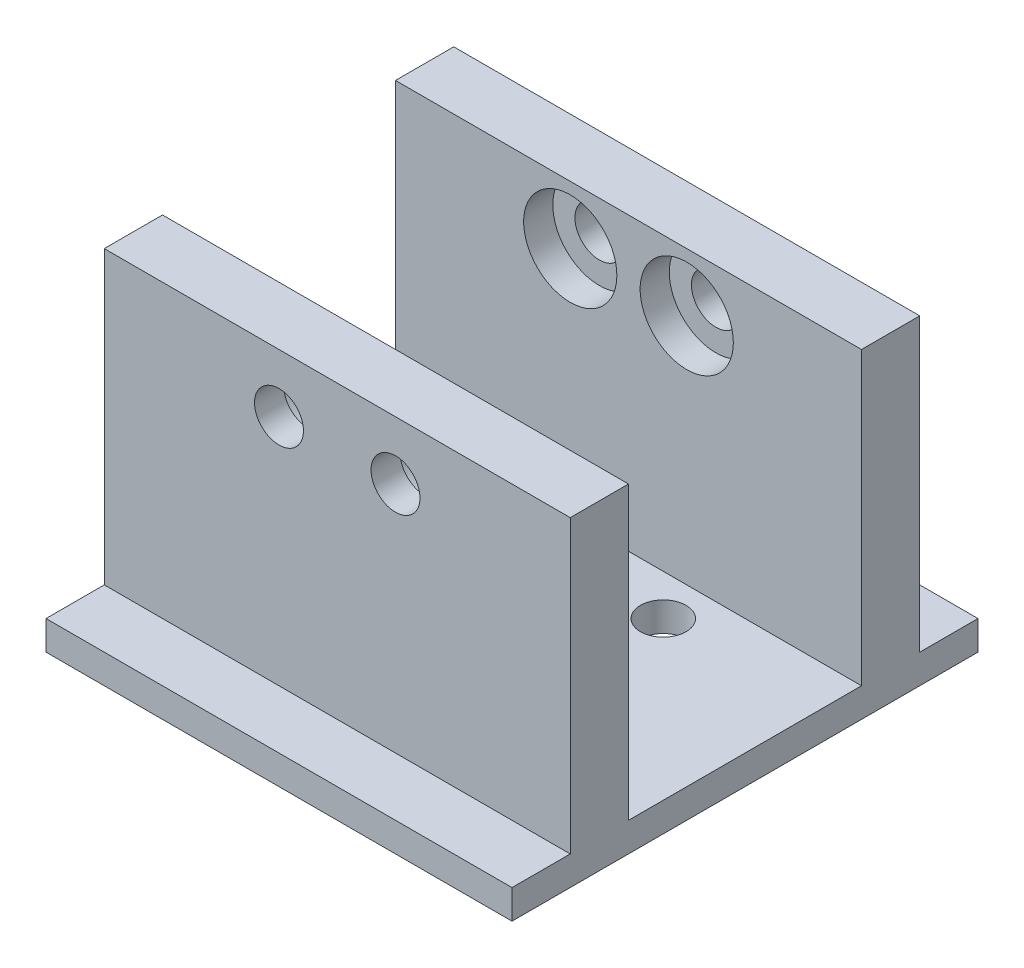
from build123d import *

# Parameters (mm, degrees)
SKETCH1_W           = 50.8
SKETCH1_H           = 50.8
SKETCH1_R           = 2.4892
SKETCH1_R_2         = 7.62
BOSS_EXTRUDE1_DEPTH = 3.175
SKETCH2_W           = 50.8
SKETCH2_H           = 6.35
BOSS_EXTRUDE2_DEPTH = 31.75
CUT_EXTRUDE1_REACH  = 63.974
SKETCH3_R           = 2.667
SKETCH5_R           = 5.08
CUT_EXTRUDE2_DEPTH  = 3.175
CUT_EXTRUDE3_START  = -3.175
SKETCH6_R           = 5.08
CUT_EXTRUDE3_DEPTH  = 3.175


with BuildPart() as part:
    # Sketch1 → Boss-Extrude1 (new body)
    with BuildSketch(Plane(origin=(0, 0, 0), x_dir=(1, 0, 0), z_dir=(0, 1, 0))):
        Rectangle(SKETCH1_W, SKETCH1_H)
        with Locations(Location((-8.243875119, 8.243875119, 0), (0, 0, 270))):
            Circle(SKETCH1_R, mode=Mode.SUBTRACT)
        with Locations(Location((8.243875119, 8.243875119, 0), (0, 0, 270))):
            Circle(SKETCH1_R, mode=Mode.SUBTRACT)
        with Locations(Location((8.243875119, -8.243875119, 0), (0, 0, 270))):
            Circle(SKETCH1_R, mode=Mode.SUBTRACT)
        with Locations(Location((-8.243875119, -8.243875119, 0), (0, 0, 270))):
            Circle(SKETCH1_R, mode=Mode.SUBTRACT)
        with Locations(Location((0, 0, 0), (0, 0, 270))):
            Circle(SKETCH1_R_2, mode=Mode.SUBTRACT)
    extrude(amount=BOSS_EXTRUDE1_DEPTH)

    # Sketch2 → Boss-Extrude2 (add)
    with BuildSketch(Plane(origin=(0, 3.175, 0), x_dir=(1, 0, 0), z_dir=(0, 1, 0))):
        with Locations((0, 15.875)):
            Rectangle(SKETCH2_W, SKETCH2_H)
        with Locations((0, -15.875)):
            Rectangle(SKETCH2_W, SKETCH2_H)
    extrude(amount=BOSS_EXTRUDE2_DEPTH)

    # Cut-Extrude1: up to this face of the body (flat: up to its plane)
    cut_extrude1_end = Plane(part.part.faces().sort_by_distance((0, 19.05, 19.05))[0])
    # Sketch3 → Cut-Extrude1 (cut, up to the picked face)
    with BuildSketch(Plane(origin=(0, 0, -19.05), x_dir=(-1, 0, 0), z_dir=(0, 0, -1)), mode=Mode.PRIVATE) as cut_extrude1_sk1:
        with Locations((-6.35, 28.575)):
            Circle(SKETCH3_R)
    cut_extrude1_tool1 = split(extrude(cut_extrude1_sk1.sketch, amount=-CUT_EXTRUDE1_REACH, mode=Mode.PRIVATE), bisect_by=cut_extrude1_end, keep=Keep.BOTH, mode=Mode.PRIVATE)
    # Sketch3 → Cut-Extrude1 (cut, up to the picked face)
    with BuildSketch(Plane(origin=(0, 0, -19.05), x_dir=(-1, 0, 0), z_dir=(0, 0, -1)), mode=Mode.PRIVATE) as cut_extrude1_sk2:
        with Locations((6.35, 28.575)):
            Circle(SKETCH3_R)
    cut_extrude1_tool2 = split(extrude(cut_extrude1_sk2.sketch, amount=-CUT_EXTRUDE1_REACH, mode=Mode.PRIVATE), bisect_by=cut_extrude1_end, keep=Keep.BOTH, mode=Mode.PRIVATE)
    add(cut_extrude1_tool1.solids().sort_by(Axis((6.35, 28.575, -19.05), (0, 0, 1)))[0], mode=Mode.SUBTRACT)
    add(cut_extrude1_tool2.solids().sort_by(Axis((-6.35, 28.575, -19.05), (0, 0, 1)))[0], mode=Mode.SUBTRACT)

    # Sketch5 → Cut-Extrude2 (cut)
    with BuildSketch(Plane.XY.offset(-12.7)):
        with Locations((-6.35, 28.575)):
            Circle(SKETCH5_R)
        with Locations((6.35, 28.575)):
            Circle(SKETCH5_R)
    extrude(amount=-CUT_EXTRUDE2_DEPTH, mode=Mode.SUBTRACT)

    # Sketch6 → Cut-Extrude3 (cut)
    with BuildSketch(Plane(origin=(0, 0, 12.7), x_dir=(-1, 0, 0), z_dir=(0, 0, -1)).offset(CUT_EXTRUDE3_START)):
        with Locations(Location((-6.35, 28.575, 0), (0, 0, 180))):
            Circle(SKETCH6_R)
        with Locations(Location((6.35, 28.575, 0), (0, 0, 180))):
            Circle(SKETCH6_R)
    extrude(amount=CUT_EXTRUDE3_DEPTH, mode=Mode.SUBTRACT)


solid = part.part
